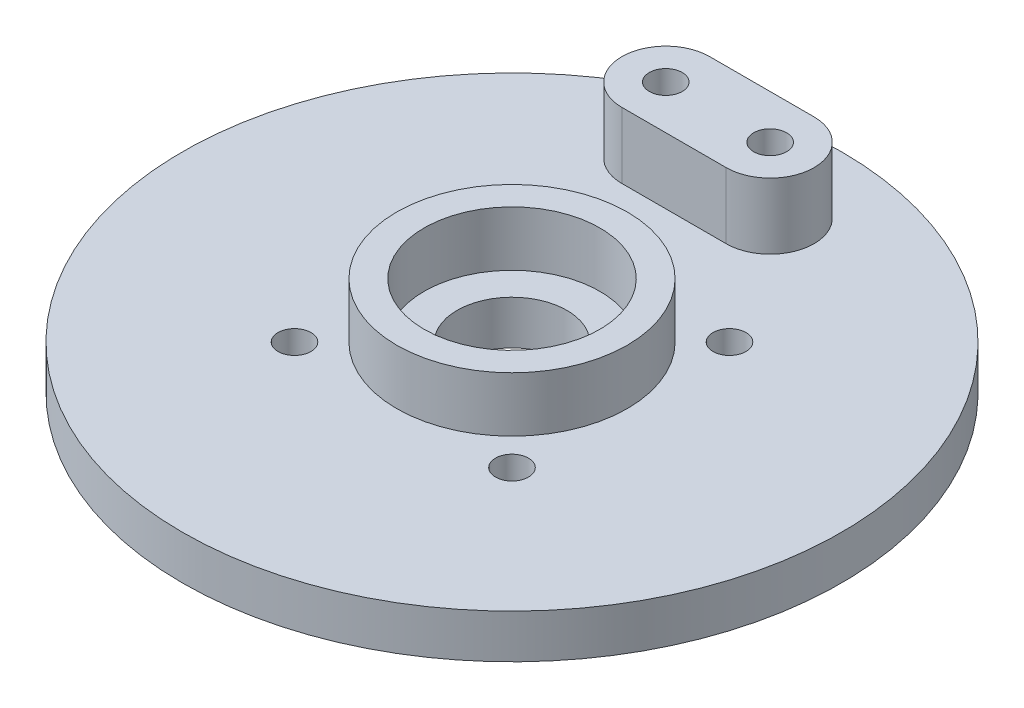
from build123d import *

# Parameters (mm, degrees)
SKETCH1_R           = 30
SKETCH1_R_2         = 5
BOSS_EXTRUDE1_DEPTH = 4
SKETCH4_R           = 10.5
SKETCH4_R_2         = 8
BOSS_EXTRUDE2_DEPTH = 5
SKETCH6_R           = 1.5
CUT_EXTRUDE3_DEPTH  = 43.720018727
BOSS_EXTRUDE3_START = 6
SKETCH7_R           = 1.5
BOSS_EXTRUDE3_DEPTH = 6
SKETCH8_R           = 1.5
CUT_EXTRUDE4_DEPTH  = 43.848570571


with BuildPart() as part:
    # Sketch1 → Boss-Extrude1 (new body)
    with BuildSketch(Plane(origin=(0, 0, 0), x_dir=(1, 0, 0), z_dir=(0, 1, 0))):
        with Locations(Location((0, 0, 0), (0, 0, 270))):
            Circle(SKETCH1_R)
        with Locations(Location((0, 0, 0), (0, 0, 270))):
            Circle(SKETCH1_R_2, mode=Mode.SUBTRACT)
    extrude(amount=BOSS_EXTRUDE1_DEPTH)

    # Sketch4 → Boss-Extrude2 (add)
    with BuildSketch(Plane(origin=(0, 4, 0), x_dir=(1, 0, 0), z_dir=(0, 1, 0))):
        with Locations(Location((0, 0, 0), (0, 0, 270))):
            Circle(SKETCH4_R)
        with Locations(Location((0, 0, 0), (0, 0, 270))):
            Circle(SKETCH4_R_2, mode=Mode.SUBTRACT)
    extrude(amount=BOSS_EXTRUDE2_DEPTH)

    # Sketch6 → Cut-Extrude3 (cut, through all)
    with BuildSketch(Plane(origin=(0, 4, 0), x_dir=(1, 0, 0), z_dir=(0, 1, 0))):
        with Locations(Location((-7.5, 21.5, 0), (0, 0, 270))):
            Circle(SKETCH6_R)
        with Locations(Location((2, 21.5, 0), (0, 0, 270))):
            Circle(SKETCH6_R)
    extrude(amount=-CUT_EXTRUDE3_DEPTH, mode=Mode.SUBTRACT)

    # Sketch7 → Boss-Extrude3 (add)
    with BuildSketch(Plane(origin=(0, 4, 0), x_dir=(1, 0, 0), z_dir=(0, 1, 0)).offset(BOSS_EXTRUDE3_START)):
        with BuildLine():
            Line((2, 25.5), (-7.5, 25.5))
            ThreePointArc((-7.5, 25.5), (-11.5, 21.5), (-7.5, 17.5))
            Line((-7.5, 17.5), (2, 17.5))
            ThreePointArc((2, 17.5), (6, 21.5), (2, 25.5))
        make_face()
        with Locations(Location((-7.5, 21.5, 0), (0, 0, 270))):
            Circle(SKETCH7_R, mode=Mode.SUBTRACT)
        with Locations(Location((2, 21.5, 0), (0, 0, 270))):
            Circle(SKETCH7_R, mode=Mode.SUBTRACT)
    extrude(amount=-BOSS_EXTRUDE3_DEPTH)

    # Sketch8 → Cut-Extrude4 (cut, through all)
    with BuildSketch(Plane(origin=(0, 4, 0), x_dir=(1, 0, 0), z_dir=(0, 1, 0))):
        with Locations(Location((-9.899494937, 9.899494937, 0), (0, 0, 270))):
            Circle(SKETCH8_R)
        with Locations(Location((9.899494937, 9.899494937, 0), (0, 0, 270))):
            Circle(SKETCH8_R)
        with Locations(Location((9.899494937, -9.899494937, 0), (0, 0, 270))):
            Circle(SKETCH8_R)
        with Locations(Location((-9.899494937, -9.899494937, 0), (0, 0, 270))):
            Circle(SKETCH8_R)
    extrude(amount=-CUT_EXTRUDE4_DEPTH, mode=Mode.SUBTRACT)


solid = part.part
